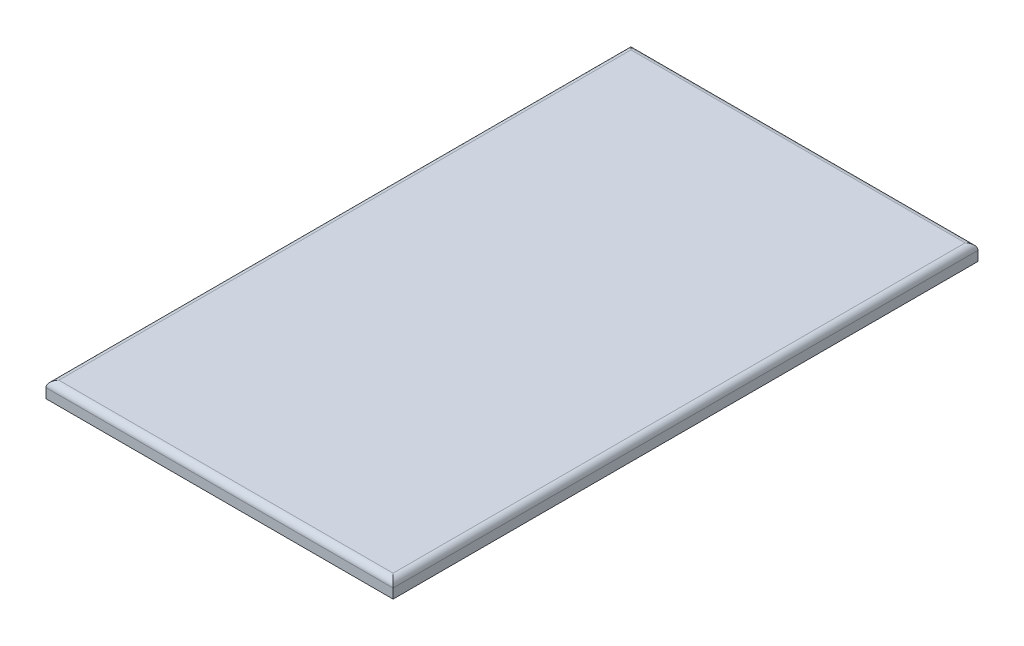
from build123d import *

# Parameters (mm, degrees)
SKETCH1_W           = 54
SKETCH1_H           = 91
BOSS_EXTRUDE1_DEPTH = 2.5
FILLET1_R           = 1


with BuildPart() as part:
    # Sketch1 → Boss-Extrude1 (new body)
    with BuildSketch(Plane(origin=(0, 0, 0), x_dir=(1, 0, 0), z_dir=(0, 1, 0))):
        Rectangle(SKETCH1_W, SKETCH1_H)
    extrude(amount=BOSS_EXTRUDE1_DEPTH)

    # Fillet1
    fillet1_edges = [part.edges().sort_by_distance(p)[0] for p in [
        (-27, 2.5, 0),
        (0, 2.5, 45.5),
        (27, 2.5, 0),
        (0, 2.5, -45.5),
    ]]
    fillet(fillet1_edges, radius=FILLET1_R)


solid = part.part
